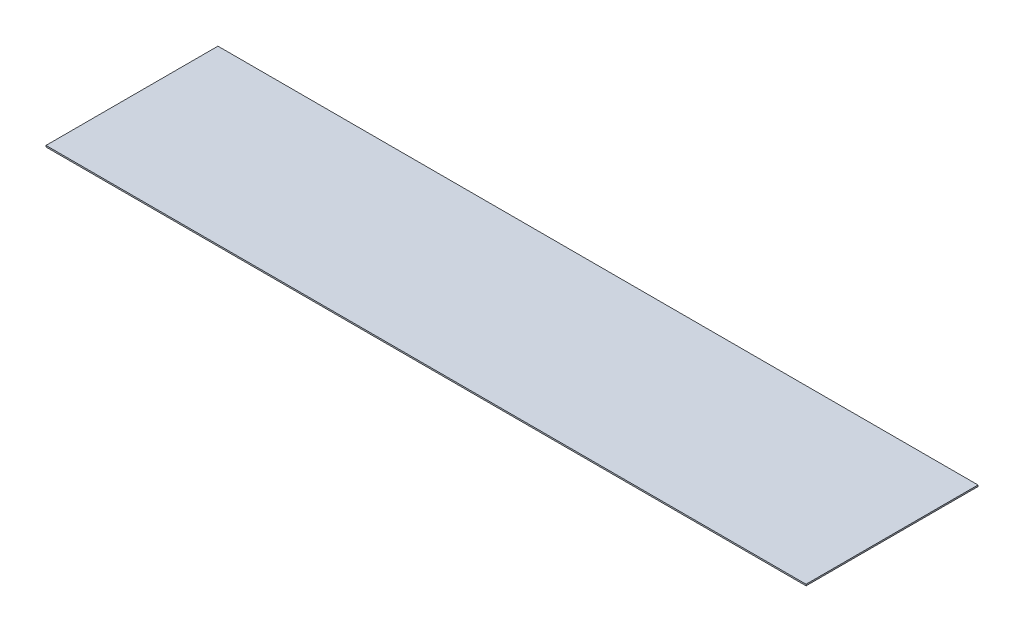
from build123d import *

# Parameters (mm, degrees)
SKETCH3_W           = 12255.5
SKETCH3_H           = 1828.8
BOSS_EXTRUDE3_DEPTH = 304.8
SKETCH4_W           = 13474.7
SKETCH4_H           = 3048
BOSS_EXTRUDE4_DEPTH = 25.4


with BuildPart() as part:
    # Sketch3 → Boss-Extrude3 (new body)
    with BuildSketch(Plane(origin=(0, 0, 0), x_dir=(-1, 0, 0), z_dir=(0, 1, 0))):
        Rectangle(SKETCH3_W, SKETCH3_H)
    extrude(amount=BOSS_EXTRUDE3_DEPTH)


with BuildPart() as body_2:
    # Sketch4 → Boss-Extrude4 (new body)
    with BuildSketch(Plane(origin=(0, 304.8, 0), x_dir=(1, 0, 0), z_dir=(0, 1, 0))):
        Rectangle(SKETCH4_W, SKETCH4_H)
    extrude(amount=BOSS_EXTRUDE4_DEPTH)


solid = Compound([part.part, body_2.part])
